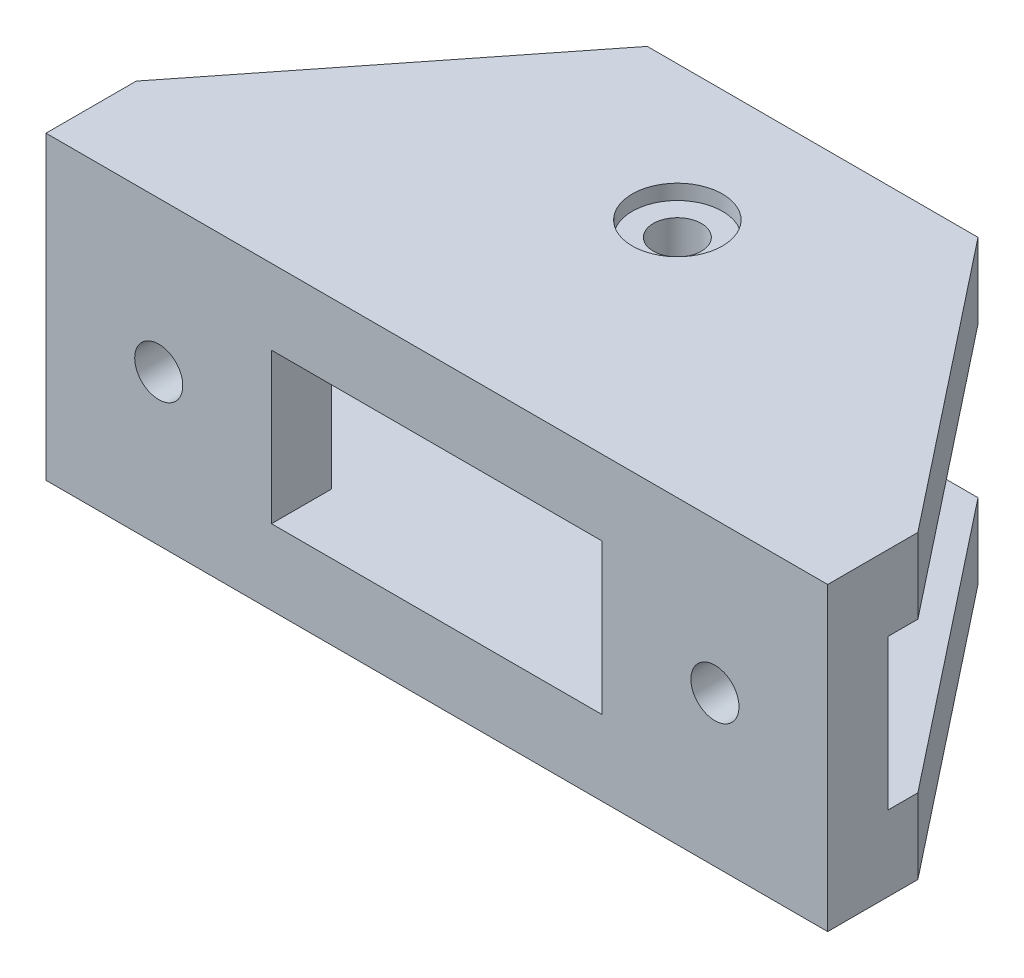
from build123d import *

# Parameters (mm, degrees)
SKETCH1_W           = 52
SKETCH1_H           = 20
BOSS_EXTRUDE1_DEPTH = 25
SKETCH2_W           = 21
SKETCH2_H           = 10
CUT_EXTRUDE1_DEPTH  = 152.858008365
CUT_EXTRUDE2_DEPTH  = 542.477569293
SKETCH4_R           = 1.6
CUT_EXTRUDE3_DEPTH  = 542.477569293
SKETCH5_W           = 22
SKETCH5_H           = 10
CUT_EXTRUDE4_DEPTH  = 4
SKETCH6_R           = 1.6
CUT_EXTRUDE5_DEPTH  = 4
SKETCH7_W           = 6
SKETCH7_H           = 7
CUT_EXTRUDE6_DEPTH  = 1
SKETCH8_W           = 6
SKETCH8_H           = 7
CUT_EXTRUDE7_DEPTH  = 1
SKETCH9_R           = 3
CUT_EXTRUDE8_DEPTH  = 1


with BuildPart() as part:
    # Sketch1 → Boss-Extrude1 (new body)
    with BuildSketch(Plane.XY):
        with Locations((514.530256366, 130.470120327)):
            Rectangle(SKETCH1_W, SKETCH1_H)
    extrude(amount=BOSS_EXTRUDE1_DEPTH)

    # Sketch2 → Cut-Extrude1 (cut, through all)
    with BuildSketch(Plane(origin=(540.530256366, 0, 0), x_dir=(0, 0, -1), z_dir=(1, 0, 0))):
        with Locations((-10.5, 130.470120327)):
            Rectangle(SKETCH2_W, SKETCH2_H)
    extrude(amount=-CUT_EXTRUDE1_DEPTH, mode=Mode.SUBTRACT)

    # Sketch3 → Cut-Extrude2 (cut, through all)
    with BuildSketch(Plane(origin=(0, 140.470120327, 0), x_dir=(1, 0, 0), z_dir=(0, 1, 0))):
        Polygon((488.530256366, -19), (503.530256366, 0), (525.530256366, 0), (540.530256366, -19), (550.000331081, -19), (550.000331081, 5.4233188), (484.277494653, 5.4233188), (484.277494653, -19), align=None)
    extrude(amount=-CUT_EXTRUDE2_DEPTH, mode=Mode.SUBTRACT)

    # Sketch4 → Cut-Extrude3 (cut, through all)
    with BuildSketch(Plane(origin=(0, 140.470120327, 0), x_dir=(1, 0, 0), z_dir=(0, 1, 0))):
        with Locations(Location((514.530256366, -9, 0), (0, 0, 270))):
            Circle(SKETCH4_R)
    extrude(amount=-CUT_EXTRUDE3_DEPTH, mode=Mode.SUBTRACT)

    # Sketch5 → Cut-Extrude4 (cut)
    with BuildSketch(Plane(origin=(0, 0, 21), x_dir=(-1, 0, 0), z_dir=(0, 0, -1))):
        with Locations((-514.530256366, 130.470120327)):
            Rectangle(SKETCH5_W, SKETCH5_H)
    extrude(amount=-CUT_EXTRUDE4_DEPTH, mode=Mode.SUBTRACT)

    # Sketch6 → Cut-Extrude5 (cut)
    with BuildSketch(Plane(origin=(0, 0, 21), x_dir=(-1, 0, 0), z_dir=(0, 0, -1))):
        with Locations((-533.030256366, 130.470120327)):
            Circle(SKETCH6_R)
        with Locations((-496.030256366, 130.470120327)):
            Circle(SKETCH6_R)
    extrude(amount=-CUT_EXTRUDE5_DEPTH, mode=Mode.SUBTRACT)

    # Sketch7 → Cut-Extrude6 (cut)
    with BuildSketch(Plane(origin=(0, 0, 21), x_dir=(-1, 0, 0), z_dir=(0, 0, -1))):
        with Locations((-496.030256366, 130.470120327)):
            Rectangle(SKETCH7_W, SKETCH7_H)
    extrude(amount=-CUT_EXTRUDE6_DEPTH, mode=Mode.SUBTRACT)

    # Sketch8 → Cut-Extrude7 (cut)
    with BuildSketch(Plane(origin=(0, 0, 21), x_dir=(-1, 0, 0), z_dir=(0, 0, -1))):
        with Locations((-533.030256366, 130.470120327)):
            Rectangle(SKETCH8_W, SKETCH8_H)
    extrude(amount=-CUT_EXTRUDE7_DEPTH, mode=Mode.SUBTRACT)

    # Sketch9 → Cut-Extrude8 (cut)
    with BuildSketch(Plane(origin=(0, 140.470120327, 0), x_dir=(1, 0, 0), z_dir=(0, 1, 0))):
        with Locations(Location((514.530256366, -9, 0), (0, 0, 270))):
            Circle(SKETCH9_R)
    extrude(amount=-CUT_EXTRUDE8_DEPTH, mode=Mode.SUBTRACT)


solid = part.part
